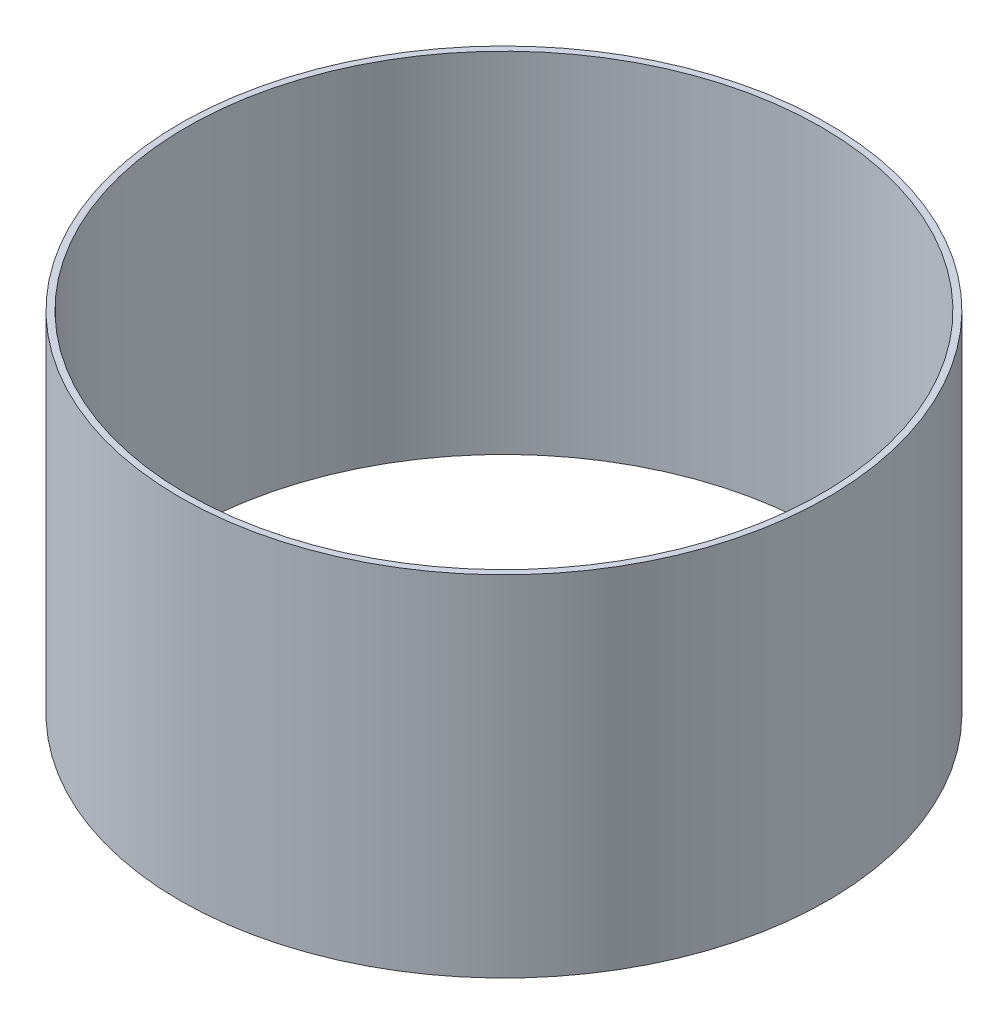
from build123d import *

# Parameters (mm, degrees)
SKETCH1_R           = 51
SKETCH1_R_2         = 50
BOSS_EXTRUDE1_DEPTH = 55


with BuildPart() as part:
    # Sketch1 → Boss-Extrude1 (new body)
    with BuildSketch(Plane(origin=(0, 0, 0), x_dir=(1, 0, 0), z_dir=(0, 1, 0))):
        with Locations(Location((0, 0, 0), (0, 0, 270))):
            Circle(SKETCH1_R)
        with Locations(Location((0, 0, 0), (0, 0, 270))):
            Circle(SKETCH1_R_2, mode=Mode.SUBTRACT)
    extrude(amount=BOSS_EXTRUDE1_DEPTH)


solid = part.part
